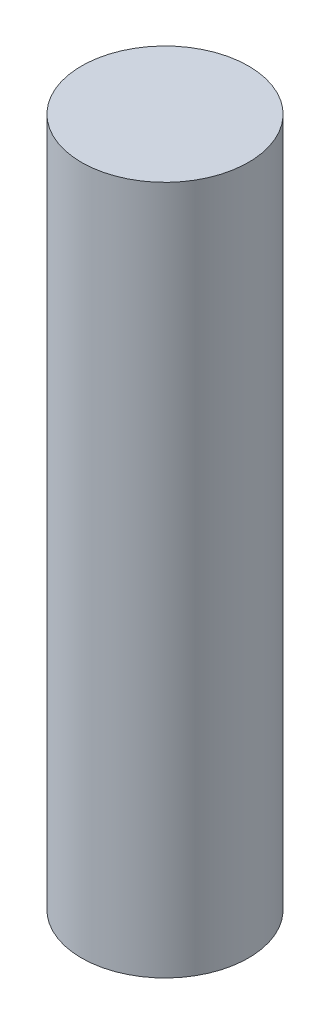
from build123d import *

# Parameters (mm, degrees)
SKETCH1_R           = 4
BOSS_EXTRUDE1_DEPTH = 33


with BuildPart() as part:
    # Sketch1 → Boss-Extrude1 (new body)
    with BuildSketch(Plane(origin=(0, 0, 0), x_dir=(1, 0, 0), z_dir=(0, 1, 0))):
        with Locations(Location((0, 0, 0), (0, 0, 270))):
            Circle(SKETCH1_R)
    extrude(amount=BOSS_EXTRUDE1_DEPTH)


solid = part.part
